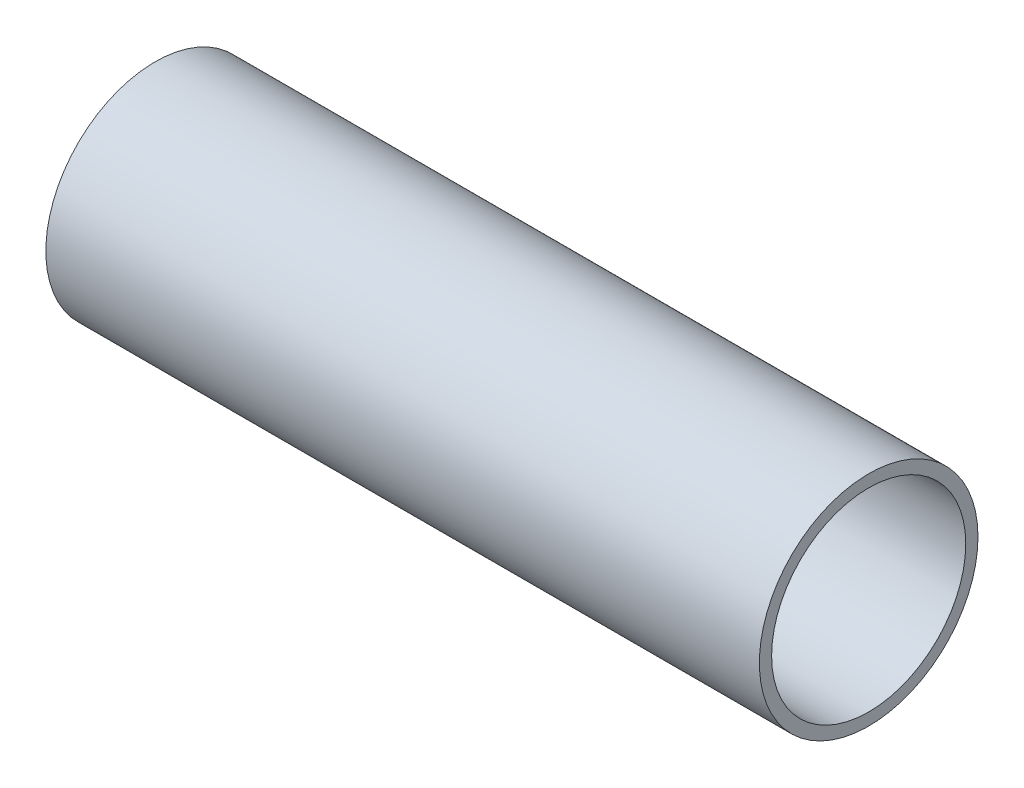
from build123d import *

# Parameters (mm, degrees)
BOSS_EXTRUDE1_START = -326.262581
SKETCH1_R           = 6.35
SKETCH1_R_2         = 5.6388
BOSS_EXTRUDE1_DEPTH = 41.447327


with BuildPart() as part:
    # Sketch1 → Boss-Extrude1 (new body)
    with BuildSketch(Plane(origin=(0, 0, 0), x_dir=(0, 0, -1), z_dir=(1, 0, 0)).offset(BOSS_EXTRUDE1_START)):
        Circle(SKETCH1_R)
        Circle(SKETCH1_R_2, mode=Mode.SUBTRACT)
    extrude(amount=BOSS_EXTRUDE1_DEPTH)


solid = part.part
